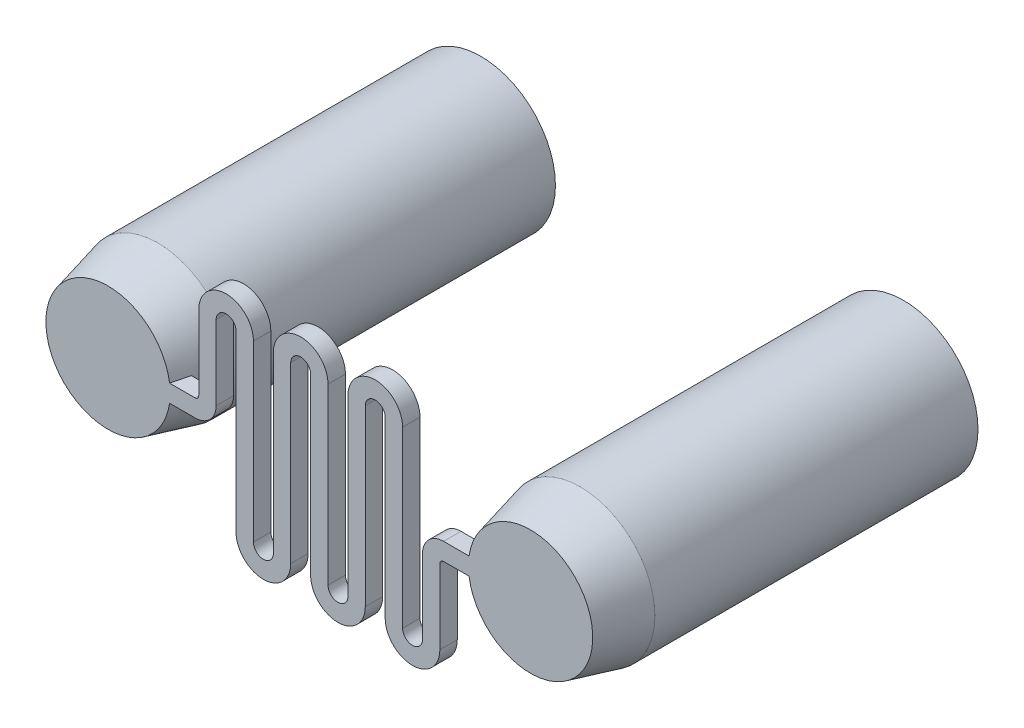
from build123d import *

# Parameters (mm, degrees)
BOSS_EXTRUDE1_DEPTH = 1.4
SKETCH5_R           = 5
CUT_EXTRUDE1_DEPTH  = 28


with BuildPart() as part:
    # Sketch2 → Boss-Extrude1 (new body)
    with BuildSketch(Plane.XY):
        with BuildLine():
            Line((-20.5, -0.7), (-13.5, -0.7))
            ThreePointArc((-13.5, -0.7), (-12.297918472, -0.202081528), (-11.8, 1))
            Line((-11.8, 1), (-11.8, 7))
            ThreePointArc((-11.8, 7), (-11, 7.8), (-10.2, 7))
            Line((-10.2, 7), (-10.2, 0))
            Line((-10.2, 0), (-10.2, -7))
            ThreePointArc((-10.2, -7), (-8, -9.2), (-5.8, -7))
            Line((-5.8, -7), (-5.8, 0))
            Line((-5.8, 0), (-5.8, 7))
            ThreePointArc((-5.8, 7), (-5, 7.8), (-4.2, 7))
            Line((-4.2, 7), (-4.2, 0))
            Line((-4.2, 0), (-4.2, -7))
            ThreePointArc((-4.2, -7), (-2, -9.2), (0.2, -7))
            Line((0.2, -7), (0.2, 0))
            Line((0.2, 0), (0.2, 7))
            ThreePointArc((0.2, 7), (1, 7.8), (1.8, 7))
            Line((1.8, 7), (1.8, 0))
            Line((1.8, 0), (1.8, -7))
            ThreePointArc((1.8, -7), (4, -9.2), (6.2, -7))
            Line((6.2, -7), (6.2, -1))
            ThreePointArc((6.2, -1), (6.287867966, -0.787867966), (6.5, -0.7))
            Line((6.5, -0.7), (13.5, -0.7))
            ThreePointArc((13.5, -0.7), (14.2, 0), (13.5, 0.7))
            Line((13.5, 0.7), (6.5, 0.7))
            ThreePointArc((6.5, 0.7), (5.297918472, 0.202081528), (4.8, -1))
            Line((4.8, -1), (4.8, -7))
            ThreePointArc((4.8, -7), (4, -7.8), (3.2, -7))
            Line((3.2, -7), (3.2, 0))
            Line((3.2, 0), (3.2, 7))
            ThreePointArc((3.2, 7), (1, 9.2), (-1.2, 7))
            Line((-1.2, 7), (-1.2, 0))
            Line((-1.2, 0), (-1.2, -7))
            ThreePointArc((-1.2, -7), (-2, -7.8), (-2.8, -7))
            Line((-2.8, -7), (-2.8, 0))
            Line((-2.8, 0), (-2.8, 7))
            ThreePointArc((-2.8, 7), (-5, 9.2), (-7.2, 7))
            Line((-7.2, 7), (-7.2, 0))
            Line((-7.2, 0), (-7.2, -7))
            ThreePointArc((-7.2, -7), (-8, -7.8), (-8.8, -7))
            Line((-8.8, -7), (-8.8, 0))
            Line((-8.8, 0), (-8.8, 7))
            ThreePointArc((-8.8, 7), (-11, 9.2), (-13.2, 7))
            Line((-13.2, 7), (-13.2, 1))
            ThreePointArc((-13.2, 1), (-13.287867966, 0.787867966), (-13.5, 0.7))
            Line((-13.5, 0.7), (-20.5, 0.7))
            ThreePointArc((-20.5, 0.7), (-21.2, 0), (-20.5, -0.7))
        make_face()
    extrude(amount=BOSS_EXTRUDE1_DEPTH)

    # Sketch3 → Revolve1 (revolve)
    with BuildSketch(Plane(origin=(0, 0, 0), x_dir=(1, 0, 0), z_dir=(0, 1, 0)), mode=Mode.PRIVATE) as revolve1_sk:
        Polygon((-20.5, -1.4), (-25.5, -1.4), (-26.5, 2.6), (-26.5, 28.6), (-20.5, 28.6), align=None)
    revolve(revolve1_sk.sketch.rotate(Axis((-20.5, 0, 1.4), (0, 0, -1)), 188.047846384), axis=Axis((-20.5, 0, 1.4), (0, 0, -1)))

    # Sketch4 → Revolve2 (revolve)
    with BuildSketch(Plane(origin=(0, 0, 0), x_dir=(1, 0, 0), z_dir=(0, 1, 0)), mode=Mode.PRIVATE) as revolve2_sk:
        Polygon((13.5, -1.4), (18.5, -1.4), (19.5, 2.6), (19.5, 28.6), (13.5, 28.6), align=None)
    revolve(revolve2_sk.sketch.rotate(Axis((13.5, 0, 1.4), (0, 0, -1)), 172.481800069), axis=Axis((13.5, 0, 1.4), (0, 0, -1)))

    # Sketch5 → Cut-Extrude1 (cut)
    with BuildSketch(Plane(origin=(0, 0, -28.6), x_dir=(-1, 0, 0), z_dir=(0, 0, -1))):
        with Locations((-13.5, 0)):
            Circle(SKETCH5_R)
        with Locations((20.5, 0)):
            Circle(SKETCH5_R)
    extrude(amount=-CUT_EXTRUDE1_DEPTH, mode=Mode.SUBTRACT)


solid = part.part
